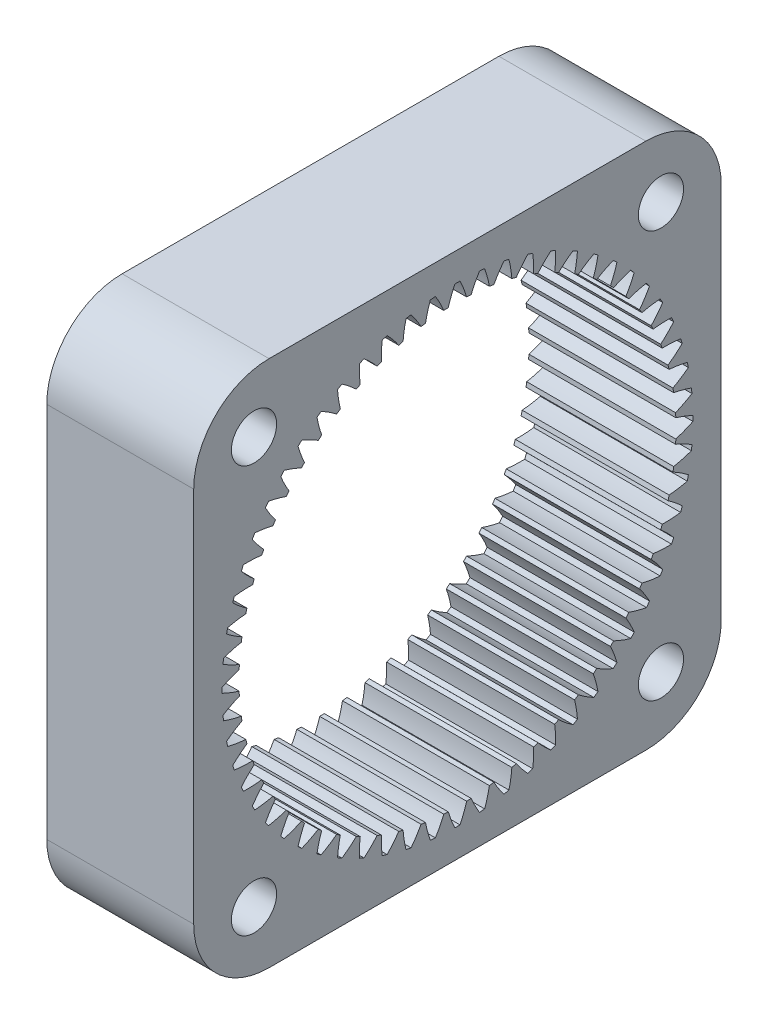
from build123d import *

# Parameters (mm, degrees)
BASPROSKE_W             = 19.5
BASPROSKE_H             = 6
TOOTHCUT_DEPTH          = 54.200093985
TEETHCUTS_COUNT         = 60
TEETHCUTS_ANGLE         = 354
SALIENTE_EXTRUIR1_DEPTH = 19.5
REDONDEO1_R             = 10
CROQUIS2_R              = 3
CORTAR_EXTRUIR1_DEPTH   = 54.200093985


with BuildPart() as part:
    # BasProSke → Base-Revolve (revolve)
    with BuildSketch(Plane(origin=(0, 0, 0), x_dir=(1, 0, 0), z_dir=(0, 1, 0)), mode=Mode.PRIVATE) as base_revolve_sk:
        with Locations((9.75, 32)):
            Rectangle(BASPROSKE_W, BASPROSKE_H)
    revolve(base_revolve_sk.sketch.rotate(Axis((-10, 0, 0), (1, 0, 0)), 180), axis=Axis((-10, 0, 0), (1, 0, 0)))

    # TooCutSke → ToothCut (cut, through all)
    with BuildSketch(Plane(origin=(0, 0, 0), x_dir=(0, 0, -1), z_dir=(1, 0, 0))):
        with BuildLine():
            ThreePointArc((1.227357706, 28.948593027), (0.830805794, 30.117149174), (0.339543276, 31.24915537))
            ThreePointArc((0.339543276, 31.24915537), (0, 31.251), (-0.339543276, 31.24915537))
            ThreePointArc((-0.339543276, 31.24915537), (-0.830805794, 30.117149174), (-1.227357706, 28.948593027))
            ThreePointArc((-1.227357706, 28.948593027), (0, 28.9746), (1.227357706, 28.948593027))
        make_face()
    toothcut = extrude(amount=TOOTHCUT_DEPTH, mode=Mode.SUBTRACT)

    # TeethCuts: ToothCut ×60 about axis
    teethcuts_axis = Axis((-10, 0, 0), (1, 0, 0))
    for i in range(1, TEETHCUTS_COUNT):
        add(toothcut.rotate(teethcuts_axis, i * TEETHCUTS_ANGLE / (TEETHCUTS_COUNT - 1)), mode=Mode.SUBTRACT)

    # Croquis1 → Saliente-Extruir1 (add, through all)
    with BuildSketch(Plane(origin=(19.5, 0, 0), x_dir=(0, 0, -1), z_dir=(1, 0, 0))):
        with BuildLine():
            Line((-1.5e-08, 35), (-35, 35))
            Line((-35, 35), (-35, -1.47e-07))
            ThreePointArc((-35, -1.47e-07), (-24.748737399, 24.748737284), (-1.5e-08, 35))
        make_face()
        with BuildLine():
            Line((35, 35), (-1.5e-08, 35))
            ThreePointArc((-1.5e-08, 35), (24.748737336, 24.748737347), (35, 0))
            Line((35, 0), (35, 35))
        make_face()
        with BuildLine():
            Line((35, -35), (35, 0))
            ThreePointArc((35, 0), (24.748737349, -24.748737334), (2.1e-08, -35))
            Line((2.1e-08, -35), (35, -35))
        make_face()
        with BuildLine():
            ThreePointArc((2.1e-08, -35), (-24.748737282, -24.748737401), (-35, -1.47e-07))
            Line((-35, -1.47e-07), (-35, -35))
            Line((-35, -35), (2.1e-08, -35))
        make_face()
    extrude(amount=-SALIENTE_EXTRUIR1_DEPTH)

    # Redondeo1
    redondeo1_edges = [part.edges().sort_by_distance(p)[0] for p in [
        (9.75, 35, 35),
        (9.75, 35, -35),
        (9.75, -35, -35),
        (9.75, -35, 35),
    ]]
    fillet(redondeo1_edges, radius=REDONDEO1_R)

    # Croquis2 → Cortar-Extruir1 (cut, through all)
    with BuildSketch(Plane(origin=(19.5, 0, 0), x_dir=(0, 0, -1), z_dir=(1, 0, 0))):
        with Locations((-27, 27)):
            Circle(CROQUIS2_R)
        with Locations((27, 27)):
            Circle(CROQUIS2_R)
        with Locations((27, -27)):
            Circle(CROQUIS2_R)
        with Locations((-27, -27)):
            Circle(CROQUIS2_R)
    extrude(amount=-CORTAR_EXTRUIR1_DEPTH, mode=Mode.SUBTRACT)


solid = part.part
